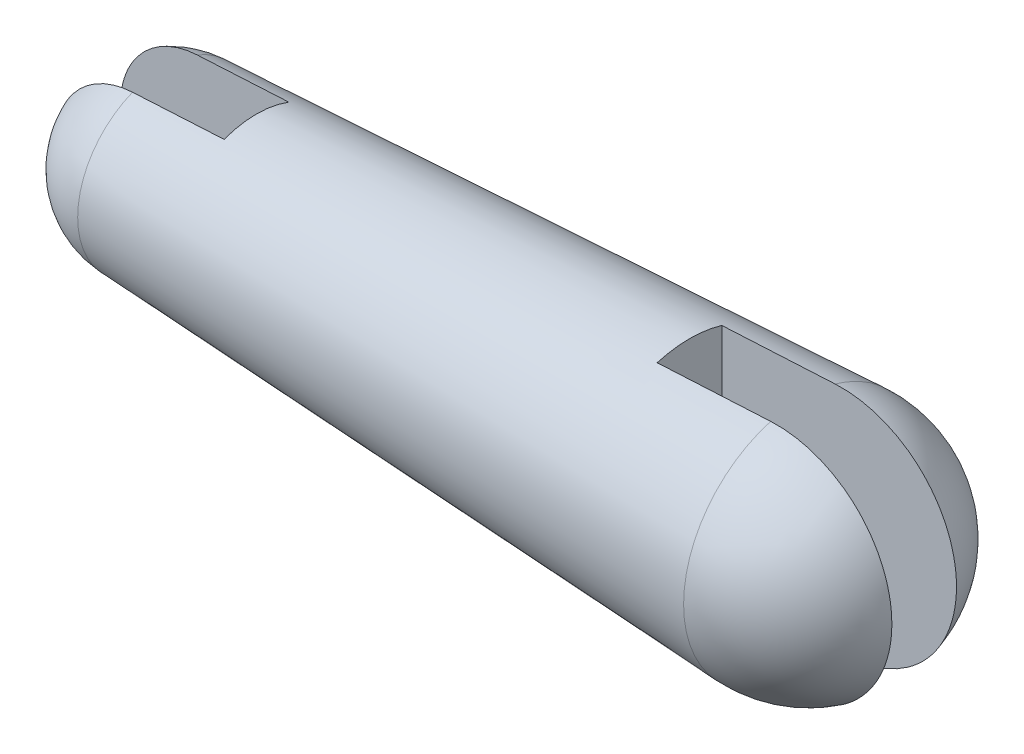
from build123d import *

# Parameters (mm, degrees)
CUT_EXTRUDE1_DEPTH      = 186.063012512
CUT_EXTRUDE1_DEPTH_BACK = 186.063012512
SKETCH4_W               = 93.98
SKETCH4_H               = 25.4
SKETCH4_W_2             = 68.58


with BuildPart() as part:
    # Sketch3 → Revolve2 (revolve)
    with BuildSketch(Plane(origin=(0, 0, 0), x_dir=(1, 0, 0), z_dir=(0, 1, 0))):
        with BuildLine():
            Line((-125.73, 0), (125.73, 0))
            Line((125.73, 0), (172.72, 0))
            ThreePointArc((172.72, 0), (158.10701278, 34.05567711), (123.356767677, 46.930031625))
            Line((123.356767677, 46.930031625), (-127.461818182, 34.246239294))
            ThreePointArc((-127.461818182, 34.246239294), (-150.581440053, 23.626468786), (-160.02, 0))
            Line((-160.02, 0), (-125.73, 0))
        make_face()
    revolve(axis=Axis((-1000, 0, 0), (1, 0, 0)))

    # Sketch4 → Cut-Extrude1 (cut, two sides: drawn at the far end of the back side and taken through both)
    with BuildSketch(Plane(origin=(0, 0, 0), x_dir=(1, 0, 0), z_dir=(0, 1, 0)).offset(-CUT_EXTRUDE1_DEPTH_BACK)):
        with Locations((125.73, 0)):
            Rectangle(SKETCH4_W, SKETCH4_H)
        with Locations((-125.73, 0)):
            Rectangle(SKETCH4_W_2, SKETCH4_H)
    extrude(amount=CUT_EXTRUDE1_DEPTH + CUT_EXTRUDE1_DEPTH_BACK, mode=Mode.SUBTRACT)


solid = part.part
